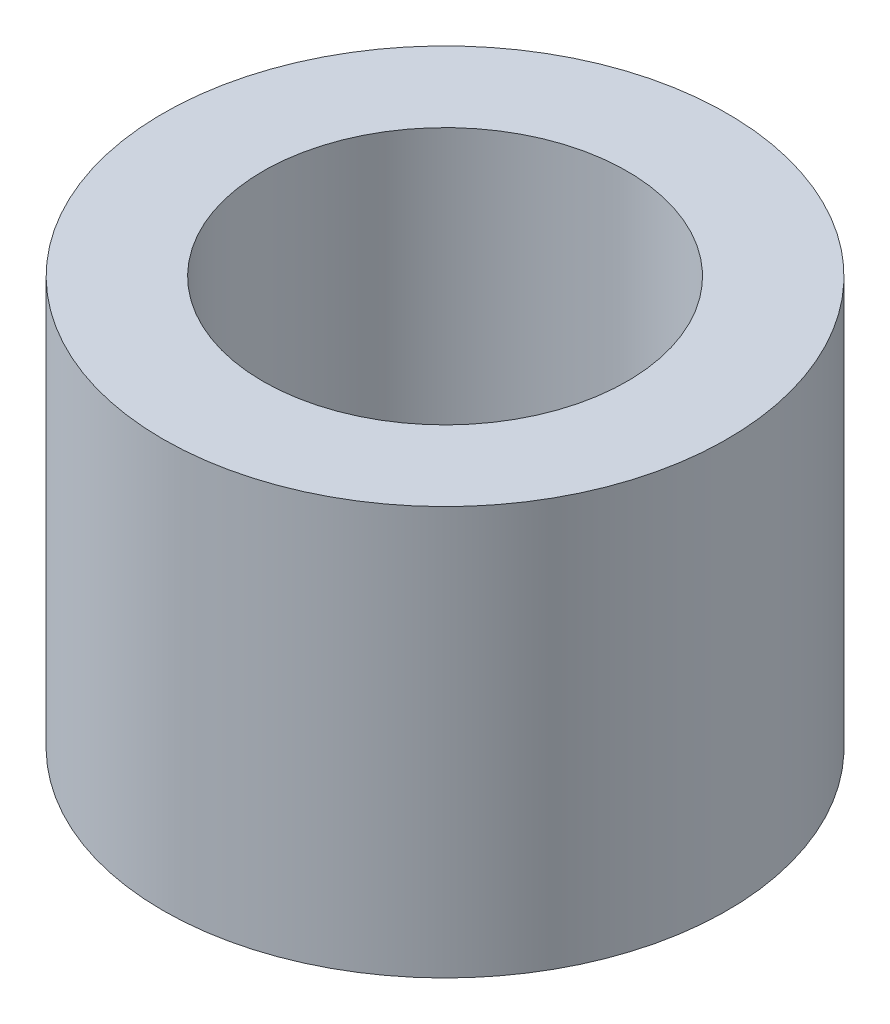
from build123d import *

# Parameters (mm, degrees)
SKETCH1_R           = 8.7757
SKETCH1_R_2         = 5.6642
BOSS_EXTRUDE1_DEPTH = 12.7


with BuildPart() as part:
    # Sketch1 → Boss-Extrude1 (new body)
    with BuildSketch(Plane(origin=(0, 0, 0), x_dir=(1, 0, 0), z_dir=(0, 1, 0))):
        with Locations(Location((0, 0, 0), (0, 0, 270))):
            Circle(SKETCH1_R)
        with Locations(Location((0, 0, 0), (0, 0, 270))):
            Circle(SKETCH1_R_2, mode=Mode.SUBTRACT)
    extrude(amount=BOSS_EXTRUDE1_DEPTH)


solid = part.part
